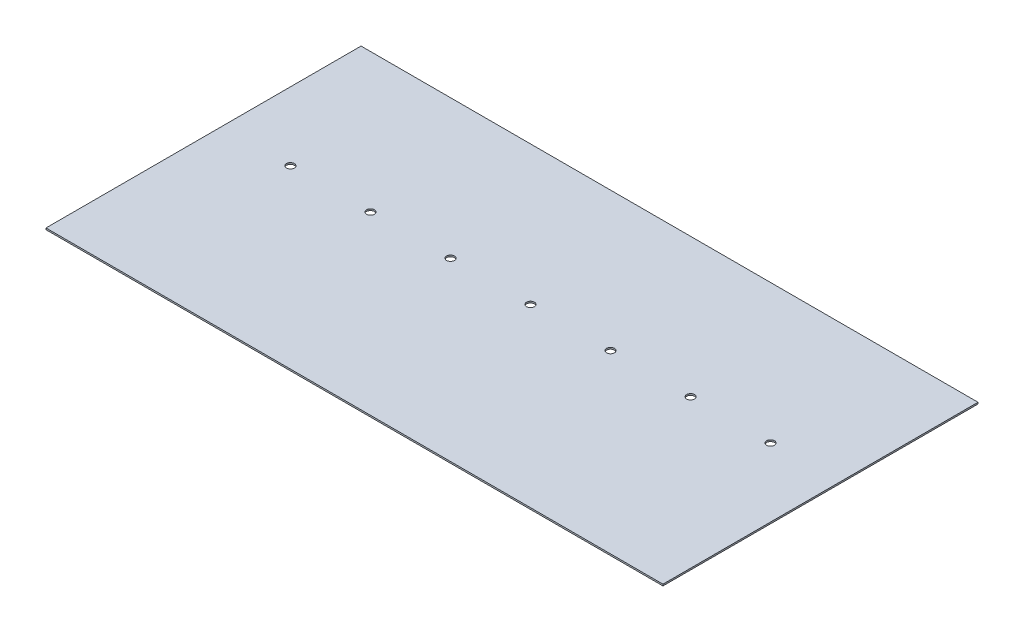
from build123d import *

# Parameters (mm, degrees)
SKETCH1_W           = 391.668
SKETCH1_H           = 199.9996
SKETCH1_R           = 2.5
BOSS_EXTRUDE1_DEPTH = 1


with BuildPart() as part:
    # Sketch1 → Boss-Extrude1 (new body)
    with BuildSketch(Plane(origin=(0, 0, 0), x_dir=(1, 0, 0), z_dir=(0, 1, 0))):
        with Locations((195.834, -99.9998)):
            Rectangle(SKETCH1_W, SKETCH1_H)
        with Locations(Location((348.234, -88.2396, 0), (0, 0, 270))):
            Circle(SKETCH1_R, mode=Mode.SUBTRACT)
        with Locations(Location((297.434, -88.2396, 0), (0, 0, 270))):
            Circle(SKETCH1_R, mode=Mode.SUBTRACT)
        with Locations(Location((246.634, -88.2396, 0), (0, 0, 270))):
            Circle(SKETCH1_R, mode=Mode.SUBTRACT)
        with Locations(Location((43.434, -88.2396, 0), (0, 0, 270))):
            Circle(SKETCH1_R, mode=Mode.SUBTRACT)
        with Locations(Location((94.234, -88.2396, 0), (0, 0, 270))):
            Circle(SKETCH1_R, mode=Mode.SUBTRACT)
        with Locations(Location((145.034, -88.2396, 0), (0, 0, 270))):
            Circle(SKETCH1_R, mode=Mode.SUBTRACT)
        with Locations(Location((195.834, -88.2396, 0), (0, 0, 270))):
            Circle(SKETCH1_R, mode=Mode.SUBTRACT)
    extrude(amount=-BOSS_EXTRUDE1_DEPTH)


solid = part.part
